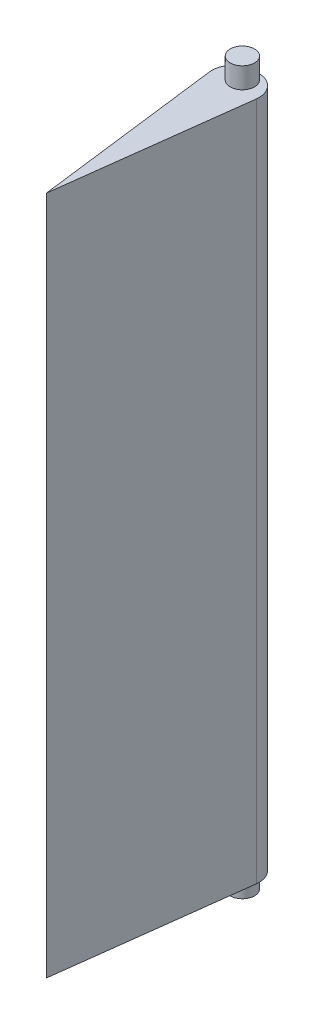
from build123d import *

# Parameters (mm, degrees)
BOSS_EXTRUDE1_DEPTH = 248.92
FILLET1_R           = 7.62
FILLET2_R           = 7.62
SKETCH3_R           = 4.445
BOSS_EXTRUDE2_DEPTH = 7.62
BOSS_EXTRUDE4_START = 7.62
SKETCH4_R           = 4.445
BOSS_EXTRUDE4_DEPTH = 7.62


with BuildPart() as part:
    # Sketch1 → Boss-Extrude1 (new body)
    with BuildSketch(Plane(origin=(0, 0, 0), x_dir=(1, 0, 0), z_dir=(0, 1, 0))):
        Polygon((0, 0), (19.304, 0), (9.652, -76.835), align=None)
    extrude(amount=BOSS_EXTRUDE1_DEPTH)

    # Fillet1
    fillet1_edges = [part.edges().sort_by_distance(p)[0] for p in [
        (0, 124.46, 0),
    ]]
    fillet(fillet1_edges, radius=FILLET1_R)

    # Fillet2
    fillet2_edges = [part.edges().sort_by_distance(p)[0] for p in [
        (19.304, 124.46, 0),
    ]]
    fillet(fillet2_edges, radius=FILLET2_R)

    # Sketch3 → Boss-Extrude2 (add)
    with BuildSketch(Plane(origin=(0, 0, 0), x_dir=(-1, 0, 0), z_dir=(0, -1, 0))):
        with Locations(Location((-9.652, -5.08, 0), (0, 0, 270))):
            Circle(SKETCH3_R)
    extrude(amount=BOSS_EXTRUDE2_DEPTH)

    # Sketch4 → Boss-Extrude4 (add)
    with BuildSketch(Plane(origin=(0, 248.92, 0), x_dir=(1, 0, 0), z_dir=(0, 1, 0)).offset(BOSS_EXTRUDE4_START)):
        with Locations(Location((9.652, -5.08, 0), (0, 0, 270))):
            Circle(SKETCH4_R)
    extrude(amount=-BOSS_EXTRUDE4_DEPTH)


solid = part.part
